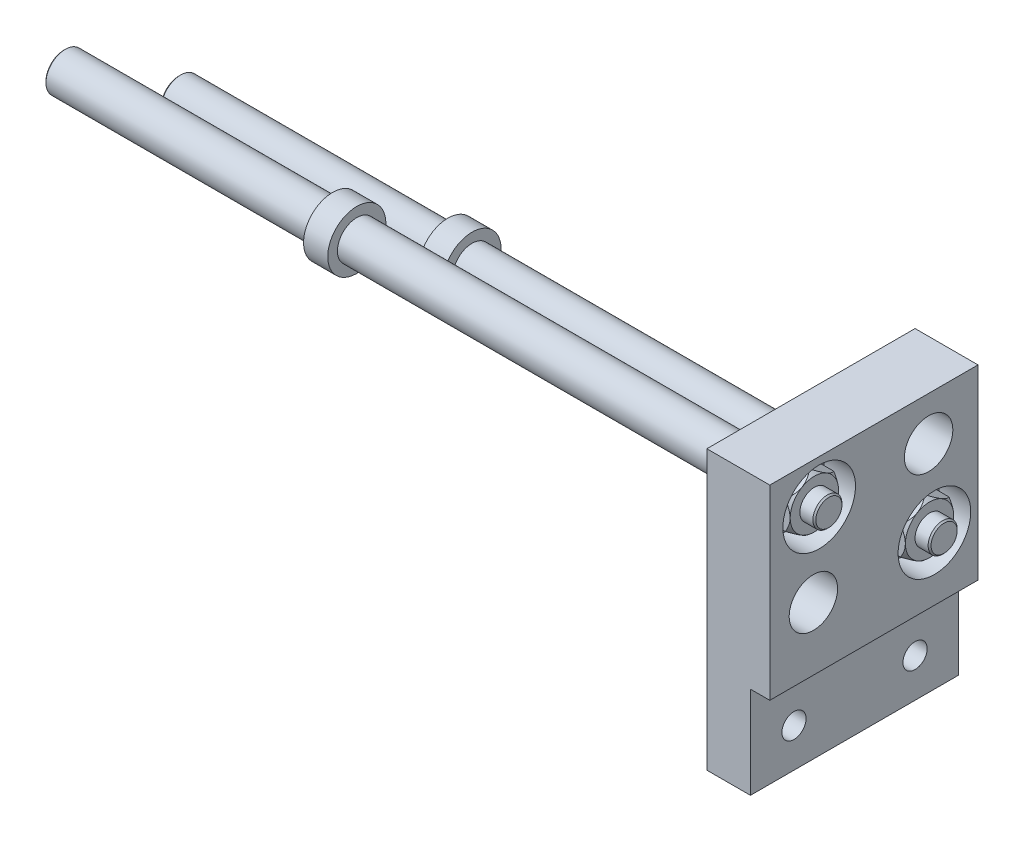
from build123d import *

# Parameters (mm, degrees)
BOSS_EXTRUDE1_DEPTH      = 10.2
BOSS_EXTRUDE1_DEPTH_BACK = 32.8
SKETCH1_W                = 13
SKETCH1_H                = 57.5
CUT_EXTRUDE1_DEPTH       = 60.975745097
CUT_EXTRUDE1_DEPTH_BACK  = 60.975745097
SKETCH3_W                = 4
SKETCH3_H                = 19
SKETCH4_R                = 7.5
CUT_EXTRUDE2_DEPTH       = 6.5
BOSS_EXTRUDE2_DEPTH      = 5.5
SKETCH8_R                = 3
BOSS_EXTRUDE3_DEPTH      = 3
CHAMFER1_SIZE            = 0.3
SKETCH10_R               = 5
CUT_EXTRUDE3_DEPTH       = 61.44079748
SKETCH9_R                = 4
BOSS_EXTRUDE4_DEPTH      = 143
CHAMFER2_SIZE            = 0.3
SKETCH11_R               = 2.5
CUT_EXTRUDE4_DEPTH       = 155.522134337
SKETCH12_R               = 6
BOSS_EXTRUDE5_DEPTH      = 5


with BuildPart() as part:
    # Sketch1 → Boss-Extrude1 (new, two sides: drawn at the far end of the back side and taken through both)
    with BuildSketch(Plane.XY.offset(-BOSS_EXTRUDE1_DEPTH_BACK)):
        with Locations((6.5, -19.75)):
            Rectangle(SKETCH1_W, SKETCH1_H)
    extrude(amount=BOSS_EXTRUDE1_DEPTH + BOSS_EXTRUDE1_DEPTH_BACK)

    # Sketch3 → Cut-Extrude1 (cut, two sides: drawn at the far end of the back side and taken through both)
    with BuildSketch(Plane.XY.offset(-CUT_EXTRUDE1_DEPTH_BACK)):
        with Locations((11, -39)):
            Rectangle(SKETCH3_W, SKETCH3_H)
    extrude(amount=CUT_EXTRUDE1_DEPTH + CUT_EXTRUDE1_DEPTH_BACK, mode=Mode.SUBTRACT)

    # Sketch4 → Cut-Extrude2 (cut)
    with BuildSketch(Plane(origin=(13, 0, 0), x_dir=(0, 0, -1), z_dir=(1, 0, 0))):
        with Locations(Location((0, 0, 0), (0, 0, 90))):
            Circle(SKETCH4_R)
        with Locations(Location((23.8, -16.5, 0), (0, 0, 90))):
            Circle(SKETCH4_R)
    extrude(amount=-CUT_EXTRUDE2_DEPTH, mode=Mode.SUBTRACT)

    # Sketch5 → Boss-Extrude2 (add)
    with BuildSketch(Plane(origin=(6.5, 0, 0), x_dir=(0, 0, -1), z_dir=(1, 0, 0))):
        Polygon((0, 5.773502692), (-5, 2.886751346), (-5, -2.886751346), (0, -5.773502692), (5, -2.886751346), (5, 2.886751346), align=None)
        Polygon((23.8, -10.726497308), (18.8, -13.613248654), (18.8, -19.386751346), (23.8, -22.273502692), (28.8, -19.386751346), (28.8, -13.613248654), align=None)
    extrude(amount=BOSS_EXTRUDE2_DEPTH)

    # Sketch6 → Cut-Revolve1 (revolve, cut)
    with BuildSketch(Plane(origin=(0, 0, 0), x_dir=(-1, 0, 0), z_dir=(0, 0, -1)), mode=Mode.PRIVATE) as cut_revolve1_sk:
        Polygon((-12, 5.773502692), (-12, 4.992217065), (-11, 5.773502692), align=None)
    revolve(cut_revolve1_sk.sketch.rotate(Axis((6.5, 0, 0), (1, 0, 0)), 180), axis=Axis((6.5, 0, 0), (1, 0, 0)), mode=Mode.SUBTRACT)

    # Sketch7 → Cut-Revolve2 (revolve, cut)
    with BuildSketch(Plane(origin=(0, 0, -23.8), x_dir=(-1, 0, 0), z_dir=(0, 0, -1)), mode=Mode.PRIVATE) as cut_revolve2_sk:
        Polygon((-11, -10.726497308), (-12, -10.726497308), (-12, -11.507782935), align=None)
    revolve(cut_revolve2_sk.sketch.rotate(Axis((6.5, -16.5, -23.8), (1, 0, 0)), 90), axis=Axis((6.5, -16.5, -23.8), (1, 0, 0)), mode=Mode.SUBTRACT)

    # Sketch8 → Boss-Extrude3 (add)
    with BuildSketch(Plane(origin=(12, 0, 0), x_dir=(0, 0, -1), z_dir=(1, 0, 0))):
        with Locations(Location((0, 0, 0), (0, 0, 90))):
            Circle(SKETCH8_R)
        with Locations(Location((23.8, -16.5, 0), (0, 0, 90))):
            Circle(SKETCH8_R)
    extrude(amount=BOSS_EXTRUDE3_DEPTH)

    # Chamfer1
    chamfer1_edges = [part.edges().sort_by_distance(p)[0] for p in [
        (15, -3, 0),
        (15, -19.5, -23.8),
    ]]
    chamfer(chamfer1_edges, length=CHAMFER1_SIZE)

    # Sketch10 → Cut-Extrude3 (cut, through all)
    with BuildSketch(Plane(origin=(0, 0, 0), x_dir=(0, 0, -1), z_dir=(1, 0, 0))):
        with Locations(Location((22.6, 0, 0), (0, 0, 90))):
            Circle(SKETCH10_R)
        with Locations(Location((-1.2, -16.5, 0), (0, 0, 90))):
            Circle(SKETCH10_R)
    extrude(amount=CUT_EXTRUDE3_DEPTH, mode=Mode.SUBTRACT)

    # Sketch9 → Boss-Extrude4 (add)
    with BuildSketch(Plane(origin=(0, 0, 0), x_dir=(0, 0, -1), z_dir=(1, 0, 0))):
        with Locations((23.8, -16.5)):
            Circle(SKETCH9_R)
        Circle(SKETCH9_R)
    extrude(amount=-BOSS_EXTRUDE4_DEPTH)

    # Chamfer2
    chamfer2_edges = [part.edges().sort_by_distance(p)[0] for p in [
        (-143, -16.5, -19.8),
        (-143, 0, 4),
    ]]
    chamfer(chamfer2_edges, length=CHAMFER2_SIZE)

    # Sketch11 → Cut-Extrude4 (cut, through all)
    with BuildSketch(Plane(origin=(0, 0, 0), x_dir=(0, 0, -1), z_dir=(1, 0, 0))):
        with Locations(Location((-1.2, -40.5, 0), (0, 0, 270))):
            Circle(SKETCH11_R)
        with Locations(Location((23.8, -40.5, 0), (0, 0, 270))):
            Circle(SKETCH11_R)
    extrude(amount=CUT_EXTRUDE4_DEPTH, mode=Mode.SUBTRACT)

    # Sketch12 → Boss-Extrude5 (add)
    with BuildSketch(Plane(origin=(-87.5, 0, 0), x_dir=(0, 0, -1), z_dir=(1, 0, 0))):
        Circle(SKETCH12_R)
        with Locations((23.8, -16.5)):
            Circle(SKETCH12_R)
    extrude(amount=BOSS_EXTRUDE5_DEPTH)


solid = part.part
